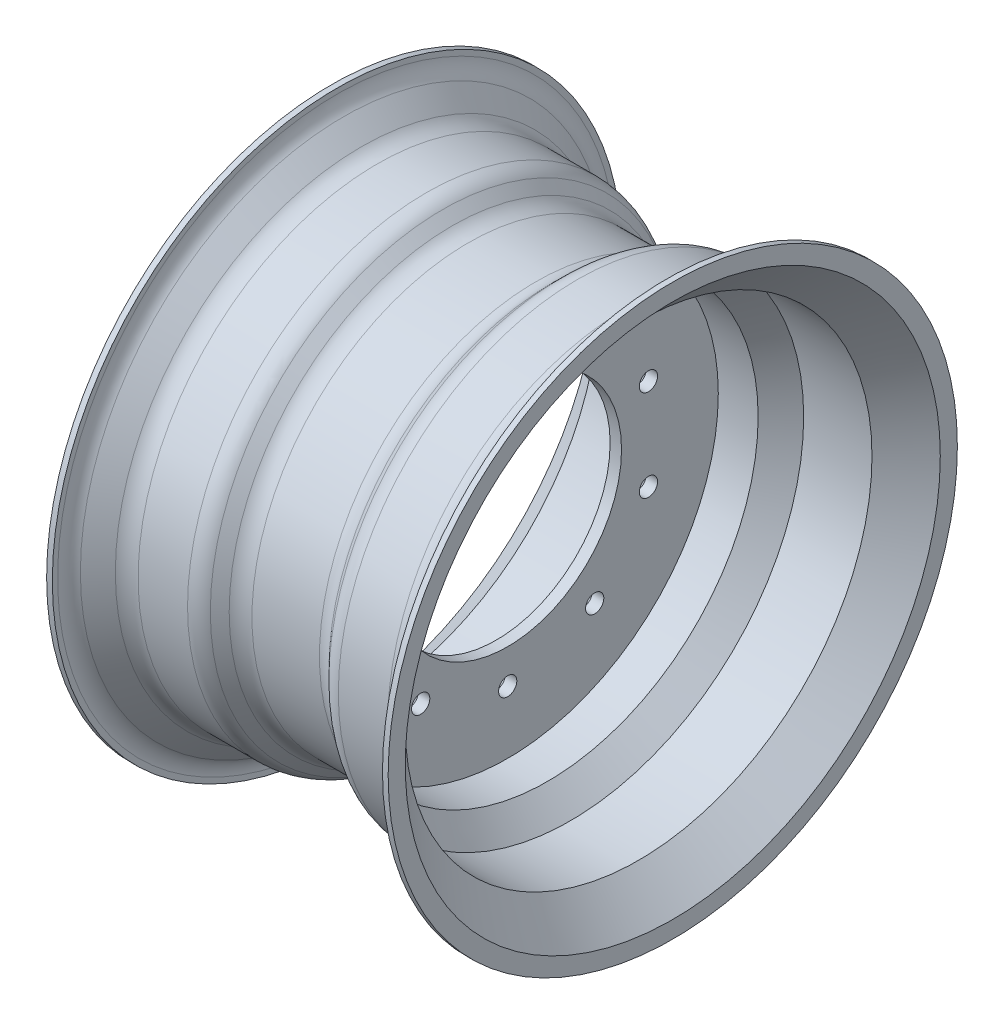
from build123d import *

# Parameters (mm, degrees)
FILLET1_R          = 20
SKETCH2_R          = 8
CUT_EXTRUDE2_DEPTH = 10
CIRPATTERN1_COUNT  = 10


with BuildPart() as part:
    # Sketch1 → Revolve1 (revolve)
    with BuildSketch(Plane.XY, mode=Mode.PRIVATE) as revolve1_sk:
        Polygon((-150, 235), (-120, 205), (-60, 205), (-40, 185), (-5, 185), (-5, 100), (5, 100), (5, 185), (40, 185), (60, 205), (120, 205), (150, 235), (150, 250), (145, 250), (145, 237.071067812), (117.928932188, 210), (57.928932188, 210), (37.928932188, 190), (-37.928932188, 190), (-57.928932188, 210), (-117.928932188, 210), (-145, 237.071067812), (-145, 250), (-150, 250), align=None)
    revolve(revolve1_sk.sketch.rotate(Axis((0, 0, 0), (-1, 0, 0)), 90), axis=Axis((0, 0, 0), (-1, 0, 0)))

    # Fillet1
    fillet1_edges = [part.edges().sort_by_distance(p)[0] for p in [
        (145, 0, 237.071067812),
        (117.928932188, 0, 210),
        (57.928932188, 0, 210),
        (37.928932188, 0, 190),
        (-37.928932188, 0, 190),
        (-57.928932188, 0, 210),
        (-117.928932188, 0, 210),
        (-145, 0, 237.071067812),
    ]]
    fillet(fillet1_edges, radius=FILLET1_R)

    # Sketch2 → Cut-Extrude2 (cut)
    with BuildSketch(Plane(origin=(5, 0, 0), x_dir=(0, 0, -1), z_dir=(1, 0, 0))):
        with Locations((0, 130)):
            Circle(SKETCH2_R)
    cut_extrude2 = extrude(amount=-CUT_EXTRUDE2_DEPTH, mode=Mode.SUBTRACT)

    # CirPattern1: Cut-Extrude2 ×10 about axis
    cirpattern1_axis = Axis((0, 0, 0), (1, 0, 0))
    for i in range(1, CIRPATTERN1_COUNT):
        add(cut_extrude2.rotate(cirpattern1_axis, i * 360 / CIRPATTERN1_COUNT), mode=Mode.SUBTRACT)


solid = part.part
